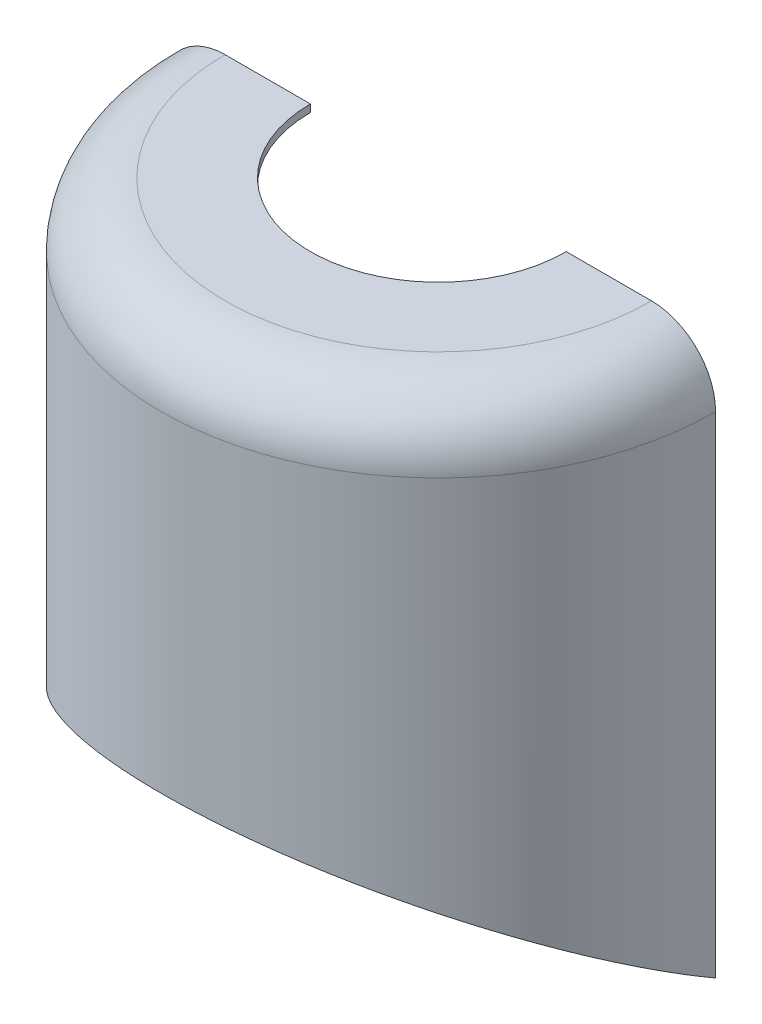
from build123d import *

# Parameters (mm, degrees)
BOSS_EXTRUDE1_DEPTH     = 52
FILLET1_R               = 6
CUT_EXTRUDE1_DEPTH      = 60.573484078
CUT_EXTRUDE1_DEPTH_BACK = 60.573484078
SHELL1_T                = -0.7
SKETCH3_R               = 12
CUT_EXTRUDE2_DEPTH      = 32


with BuildPart() as part:
    # Sketch1 → Boss-Extrude1 (new body)
    with BuildSketch(Plane(origin=(0, 0, 0), x_dir=(1, 0, 0), z_dir=(0, 1, 0))):
        with BuildLine():
            Line((26, 13), (-26, 13))
            ThreePointArc((-26, 13), (0, -13), (26, 13))
        make_face()
    extrude(amount=BOSS_EXTRUDE1_DEPTH)

    # Fillet1
    fillet1_edges = [part.edges().sort_by_distance(p)[0] for p in [
        (0, 52, 13),
    ]]
    fillet(fillet1_edges, radius=FILLET1_R)

    # Sketch2 → Cut-Extrude1 (cut, two sides: drawn at the far end of the back side and taken through both)
    with BuildSketch(Plane(origin=(0, 0, 0), x_dir=(0, 0, -1), z_dir=(1, 0, 0)).offset(-CUT_EXTRUDE1_DEPTH_BACK)):
        Polygon((13, 0), (-13, 15), (-13, 0), align=None)
    extrude(amount=CUT_EXTRUDE1_DEPTH + CUT_EXTRUDE1_DEPTH_BACK, mode=Mode.SUBTRACT)

    # Shell1
    shell1_openings = [part.faces().sort_by_distance(p)[0] for p in [
        (0, 25.858277944, -13),
    ]]
    offset(amount=SHELL1_T, openings=shell1_openings)

    # Sketch3 → Cut-Extrude2 (cut)
    with BuildSketch(Plane(origin=(0, 52, 0), x_dir=(1, 0, 0), z_dir=(0, 1, 0))):
        with Locations((0, 13)):
            Circle(SKETCH3_R)
    extrude(amount=-CUT_EXTRUDE2_DEPTH, mode=Mode.SUBTRACT)


solid = part.part
